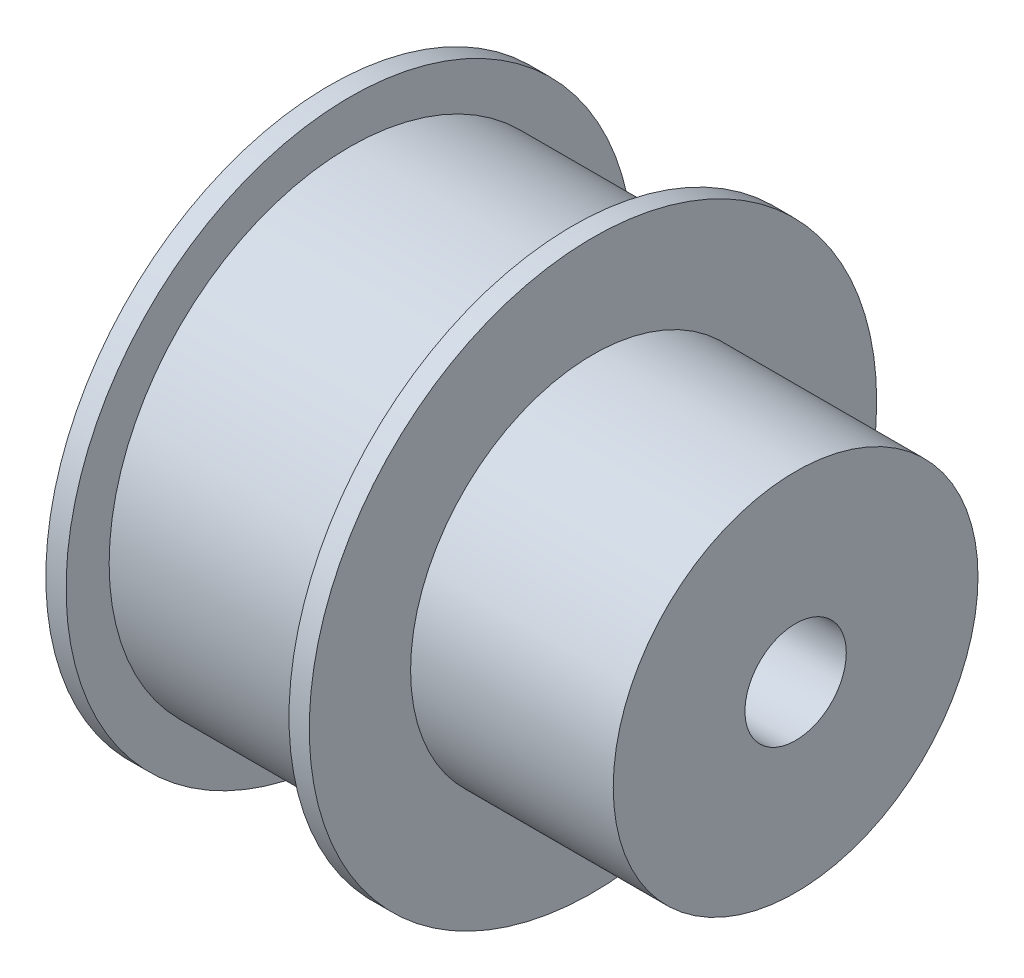
from build123d import *

# Parameters (mm, degrees)
SKETCH1_R           = 14
BOSS_EXTRUDE1_DEPTH = 1
SKETCH2_R           = 11.875
BOSS_EXTRUDE2_DEPTH = 11
SKETCH3_R           = 14
BOSS_EXTRUDE3_DEPTH = 1
SKETCH4_R           = 9
BOSS_EXTRUDE4_DEPTH = 10
SKETCH5_R           = 2.5
CUT_EXTRUDE1_DEPTH  = 31.347981811


with BuildPart() as part:
    # Sketch1 → Boss-Extrude1 (new body)
    with BuildSketch(Plane(origin=(0, 0, 0), x_dir=(0, 0, -1), z_dir=(1, 0, 0))):
        Circle(SKETCH1_R)
    extrude(amount=BOSS_EXTRUDE1_DEPTH)

    # Sketch2 → Boss-Extrude2 (add)
    with BuildSketch(Plane(origin=(1, 0, 0), x_dir=(0, 0, -1), z_dir=(1, 0, 0))):
        Circle(SKETCH2_R)
    extrude(amount=BOSS_EXTRUDE2_DEPTH)

    # Sketch3 → Boss-Extrude3 (add)
    with BuildSketch(Plane(origin=(12, 0, 0), x_dir=(0, 0, -1), z_dir=(1, 0, 0))):
        Circle(SKETCH3_R)
    extrude(amount=BOSS_EXTRUDE3_DEPTH)

    # Sketch4 → Boss-Extrude4 (add)
    with BuildSketch(Plane(origin=(13, 0, 0), x_dir=(0, 0, -1), z_dir=(1, 0, 0))):
        Circle(SKETCH4_R)
    extrude(amount=BOSS_EXTRUDE4_DEPTH)

    # Sketch5 → Cut-Extrude1 (cut, through all)
    with BuildSketch(Plane(origin=(23, 0, 0), x_dir=(0, 0, -1), z_dir=(1, 0, 0))):
        Circle(SKETCH5_R)
    extrude(amount=-CUT_EXTRUDE1_DEPTH, mode=Mode.SUBTRACT)


solid = part.part
